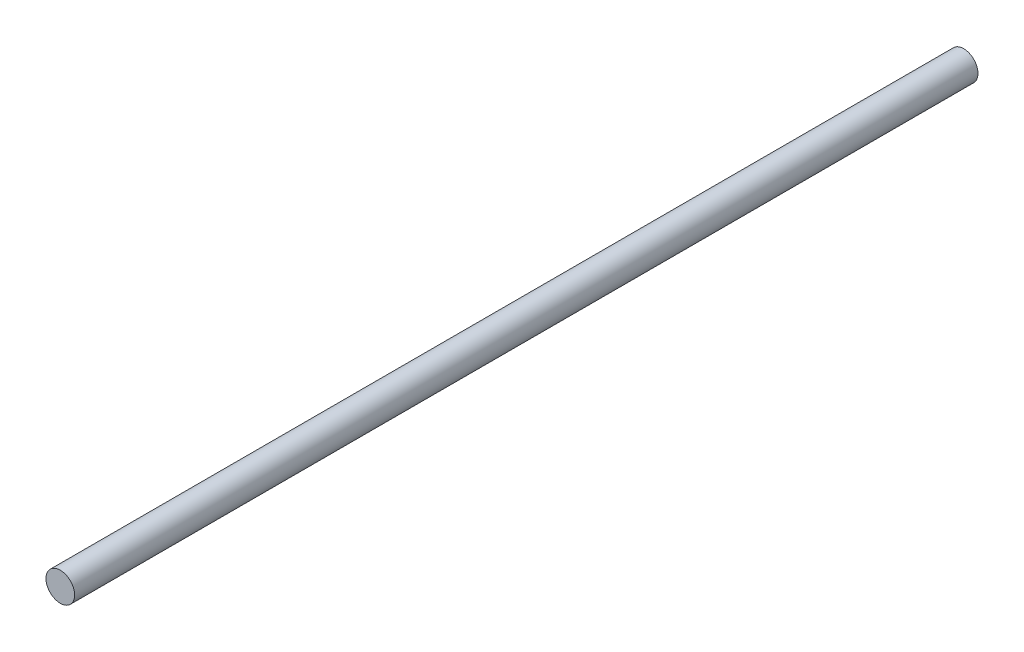
from build123d import *

# Parameters (mm, degrees)
SKETCH_1_R        = 1.5
EXTRUDE_203_DEPTH = 94.55


with BuildPart() as part:
    # 草图1 → Extrude 203 (new body)
    with BuildSketch(Plane.XY):
        Circle(SKETCH_1_R)
    extrude(amount=EXTRUDE_203_DEPTH)


solid = part.part
